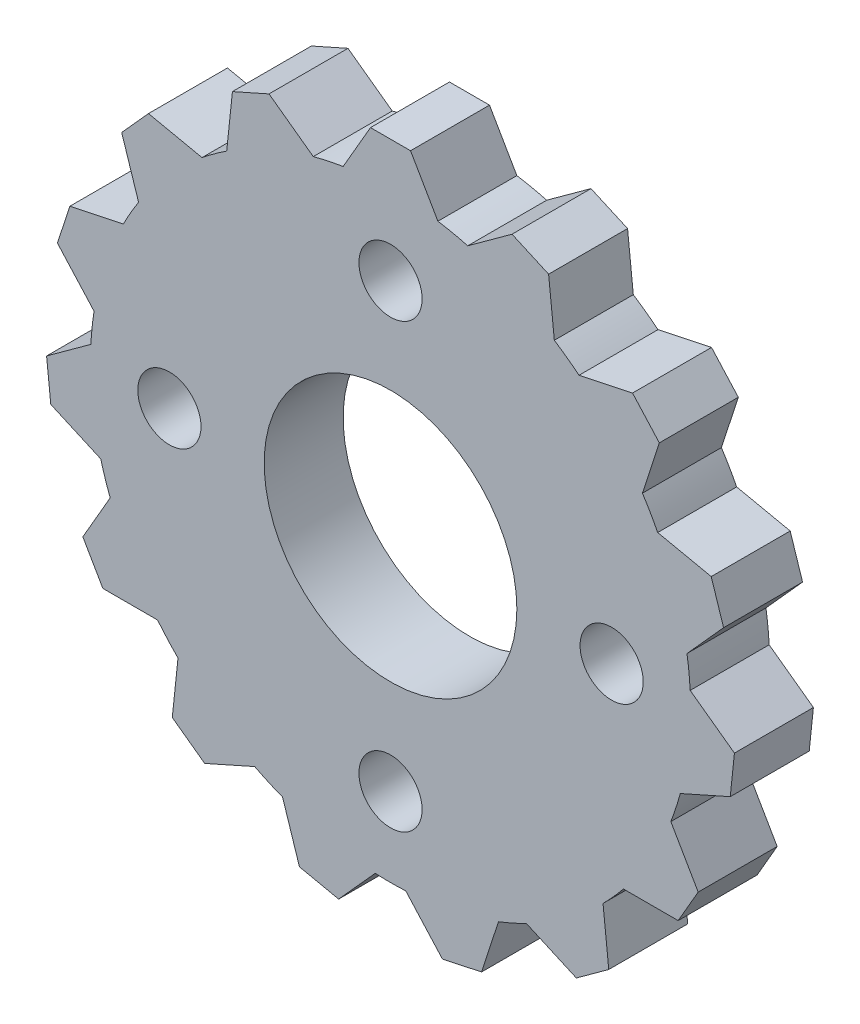
from build123d import *

# Parameters (mm, degrees)
SKETCH1_R           = 9.5
SKETCH1_R_2         = 4
SKETCH1_R_3         = 1
BOSS_EXTRUDE1_DEPTH = 2.5
BOSS_EXTRUDE2_DEPTH = 2.5
CIRPATTERN1_COUNT   = 15


with BuildPart() as part:
    # Sketch1 → Boss-Extrude1 (new body)
    with BuildSketch(Plane.XY):
        Circle(SKETCH1_R)
        Circle(SKETCH1_R_2, mode=Mode.SUBTRACT)
        with Locations((0, 7)):
            Circle(SKETCH1_R_3, mode=Mode.SUBTRACT)
        with Locations((7, 0)):
            Circle(SKETCH1_R_3, mode=Mode.SUBTRACT)
        with Locations((0, -7)):
            Circle(SKETCH1_R_3, mode=Mode.SUBTRACT)
        with Locations((-7, 0)):
            Circle(SKETCH1_R_3, mode=Mode.SUBTRACT)
    extrude(amount=BOSS_EXTRUDE1_DEPTH)

    # Sketch2 → Boss-Extrude2 (add)
    with BuildSketch(Plane.XY):
        Polygon((-1.5, 9.38083152), (-0.633974596, 10.88083152), (0.633974596, 10.88083152), (1.5, 9.38083152), align=None)
    boss_extrude2 = extrude(amount=BOSS_EXTRUDE2_DEPTH)

    # CirPattern1: Boss-Extrude2 ×15 about axis
    cirpattern1_axis = Axis((0, 0, 0), (0, 0, 1))
    for i in range(1, CIRPATTERN1_COUNT):
        add(boss_extrude2.rotate(cirpattern1_axis, i * 360 / CIRPATTERN1_COUNT))


solid = part.part
